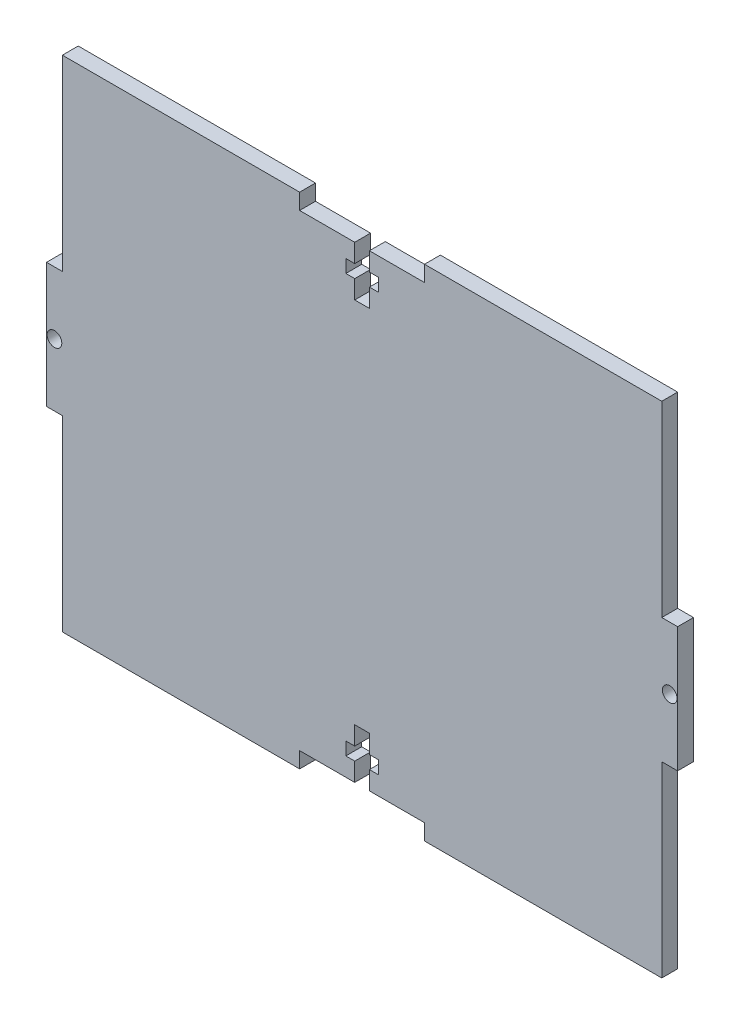
from build123d import *

# Parameters (mm, degrees)
SKETCH1_R           = 1.47
BOSS_EXTRUDE1_DEPTH = 1.5875


with BuildPart() as part:
    # Sketch1 → Boss-Extrude1 (new, symmetric)
    with BuildSketch(Plane.XY):
        Polygon((-12.5, 50), (-60, 50), (-60, 12.5), (-63.175, 12.5), (-63.175, -12.5), (-60, -12.5), (-60, -50), (-12.5, -50), (-12.5, -46.825), (-1.47, -46.825), (-1.47, -43.125), (-3.25, -43.125), (-3.25, -40.525), (-1.47, -40.525), (-1.47, -36.825), (1.47, -36.825), (1.47, -40.525), (3.25, -40.525), (3.25, -43.125), (1.47, -43.125), (1.47, -46.825), (12.5, -46.825), (12.5, -50), (60, -50), (60, -12.5), (63.175, -12.5), (63.175, 12.5), (60, 12.5), (60, 50), (12.5, 50), (12.5, 46.825), (1.47, 46.825), (1.47, 43.125), (3.25, 43.125), (3.25, 40.525), (1.47, 40.525), (1.47, 36.825), (-1.47, 36.825), (-1.47, 40.525), (-3.25, 40.525), (-3.25, 43.125), (-1.47, 43.125), (-1.47, 46.825), (-12.5, 46.825), align=None)
        with Locations((-61.5875, 0)):
            Circle(SKETCH1_R, mode=Mode.SUBTRACT)
        with Locations(Location((61.5875, 0, 0), (0, 0, 180))):
            Circle(SKETCH1_R, mode=Mode.SUBTRACT)
    extrude(amount=BOSS_EXTRUDE1_DEPTH, both=True)


solid = part.part
